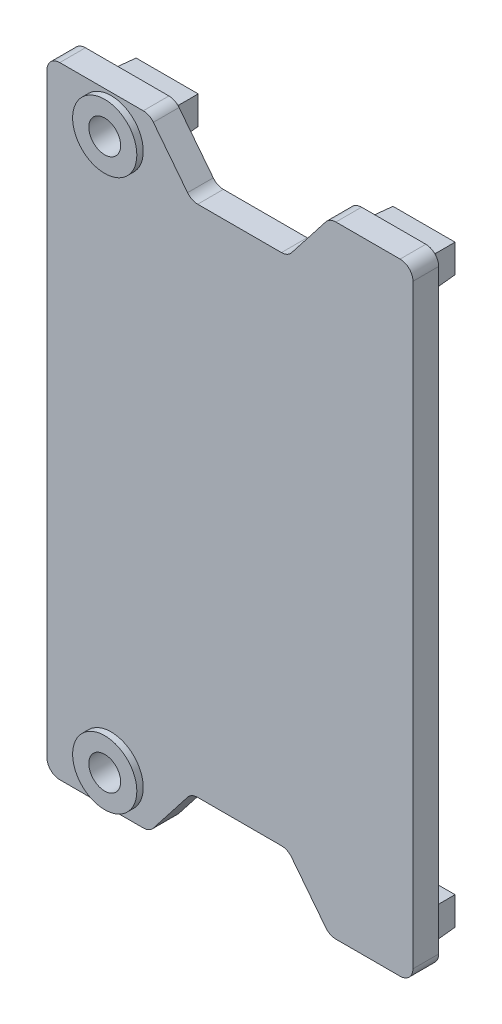
from build123d import *

# Parameters (mm, degrees)
SKETCH1_R                     = 1.575
BOSS_EXTRUDE1_DEPTH           = 2.54
SKETCH2_R                     = 3.175
SKETCH2_R_2                   = 1.575
BOSS_EXTRUDE2_DEPTH           = 0.635
SKETCH3_W                     = 6.35
SKETCH3_H                     = 3
BOSS_EXTRUDE3_DEPTH           = 1
SKETCH4_W                     = 6.35
SKETCH4_H                     = 3
BOSS_EXTRUDE4_DEPTH           = 2
BOSS_EXTRUDE4_DRAFT           = 3
BOSS_EXTRUDE4_PROFILE_2_DEPTH = 2
BOSS_EXTRUDE4_PROFILE_2_DRAFT = 3


with BuildPart() as part:
    # Sketch1 → Boss-Extrude1 (new body)
    with BuildSketch(Plane.XY):
        with BuildLine():
            Line((-184.15, 30.71), (-180.975, 30.71))
            ThreePointArc((-180.975, 30.71), (-180.417860718, 30.58126939), (-179.973667703, 30.221174521))
            Line((-179.973667703, 30.221174521), (-176.593849938, 25.888825479))
            ThreePointArc((-176.593849938, 25.888825479), (-176.149656923, 25.52873061), (-175.592517642, 25.4))
            Line((-175.592517642, 25.4), (-167.307484897, 25.4))
            ThreePointArc((-167.307484897, 25.4), (-166.750344217, 25.528730053), (-166.306150062, 25.888825479))
            Line((-166.306150062, 25.888825479), (-162.926332297, 30.221174521))
            ThreePointArc((-162.926332297, 30.221174521), (-162.482139282, 30.58126939), (-161.925, 30.71))
            Line((-161.925, 30.71), (-155.575, 30.71))
            ThreePointArc((-155.575, 30.71), (-154.676974388, 30.338025612), (-154.305, 29.44))
            Line((-154.305, 29.44), (-154.305, 0))
            Line((-154.305, 0), (-190.5, 0))
            Line((-190.5, 0), (-190.5, 25.4))
            Line((-190.5, 25.4), (-190.5, 29.44))
            ThreePointArc((-190.5, 29.44), (-190.128025612, 30.338025612), (-189.23, 30.71))
            Line((-189.23, 30.71), (-184.15, 30.71))
        make_face()
        with Locations((-184.15, 27.24645)):
            Circle(SKETCH1_R, mode=Mode.SUBTRACT)
    extrude(amount=BOSS_EXTRUDE1_DEPTH)

    # Sketch2 → Boss-Extrude2 (add)
    with BuildSketch(Plane.XY.offset(2.54)):
        with Locations((-184.15, 27.24645)):
            Circle(SKETCH2_R)
        with Locations((-184.15, 27.24645)):
            Circle(SKETCH2_R_2, mode=Mode.SUBTRACT)
    extrude(amount=BOSS_EXTRUDE2_DEPTH)

    # Sketch3 → Boss-Extrude3 (add)
    with BuildSketch(Plane(origin=(0, 0, 0), x_dir=(-1, 0, 0), z_dir=(0, 0, -1))):
        with Locations((184.15, 27.94)):
            Rectangle(SKETCH3_W, SKETCH3_H)
        with Locations((158.75, 27.94)):
            Rectangle(SKETCH3_W, SKETCH3_H)
    extrude(amount=BOSS_EXTRUDE3_DEPTH)


with BuildPart() as boss_extrude4_tool:
    # Sketch4 → Boss-Extrude4 (with draft: the straight prism first)
    with BuildSketch(Plane(origin=(0, 0, -1), x_dir=(-1, 0, 0), z_dir=(0, 0, -1))):
        with Locations((184.15, 27.94)):
            Rectangle(SKETCH4_W, SKETCH4_H)
    extrude(amount=BOSS_EXTRUDE4_DEPTH)
    # Boss-Extrude4: the draft: its side faces are tilted about the plane it starts from
    boss_extrude4_sides = [boss_extrude4_tool.faces().sort_by_distance(p)[0] for p in [
        (-180.975, 27.94, -2),
        (-184.15, 26.44, -2),
        (-187.325, 27.94, -2),
        (-184.15, 29.44, -2),
    ]]
    draft(boss_extrude4_sides, Plane(origin=(0, 0, -1), x_dir=(-1, 0, 0), z_dir=(0, 0, -1)), BOSS_EXTRUDE4_DRAFT)


with BuildPart() as part_1:
    add(part.part)

    # Boss-Extrude4: add boss_extrude4_tool
    add(boss_extrude4_tool.part)


with BuildPart() as boss_extrude4_profile_2_tool:
    # Sketch4 → Boss-Extrude4 profile 2 (with draft: the straight prism first)
    with BuildSketch(Plane(origin=(0, 0, -1), x_dir=(-1, 0, 0), z_dir=(0, 0, -1))):
        with Locations((158.75, 27.94)):
            Rectangle(SKETCH4_W, SKETCH4_H)
    extrude(amount=BOSS_EXTRUDE4_PROFILE_2_DEPTH)
    # Boss-Extrude4 profile 2: the draft: its side faces are tilted about the plane it starts from
    boss_extrude4_profile_2_sides = [boss_extrude4_profile_2_tool.faces().sort_by_distance(p)[0] for p in [
        (-155.575, 27.94, -2),
        (-158.75, 26.44, -2),
        (-161.925, 27.94, -2),
        (-158.75, 29.44, -2),
    ]]
    draft(boss_extrude4_profile_2_sides, Plane(origin=(0, 0, -1), x_dir=(-1, 0, 0), z_dir=(0, 0, -1)), BOSS_EXTRUDE4_PROFILE_2_DRAFT)


with BuildPart() as part_2:
    add(part_1.part)

    # Boss-Extrude4 profile 2: add boss_extrude4_profile_2_tool
    add(boss_extrude4_profile_2_tool.part)

    # Mirror1: part across plane


with BuildPart() as part_3:
    add(part_2.part)
    add(part_2.part.mirror(Plane.ZX))


solid = part_3.part
